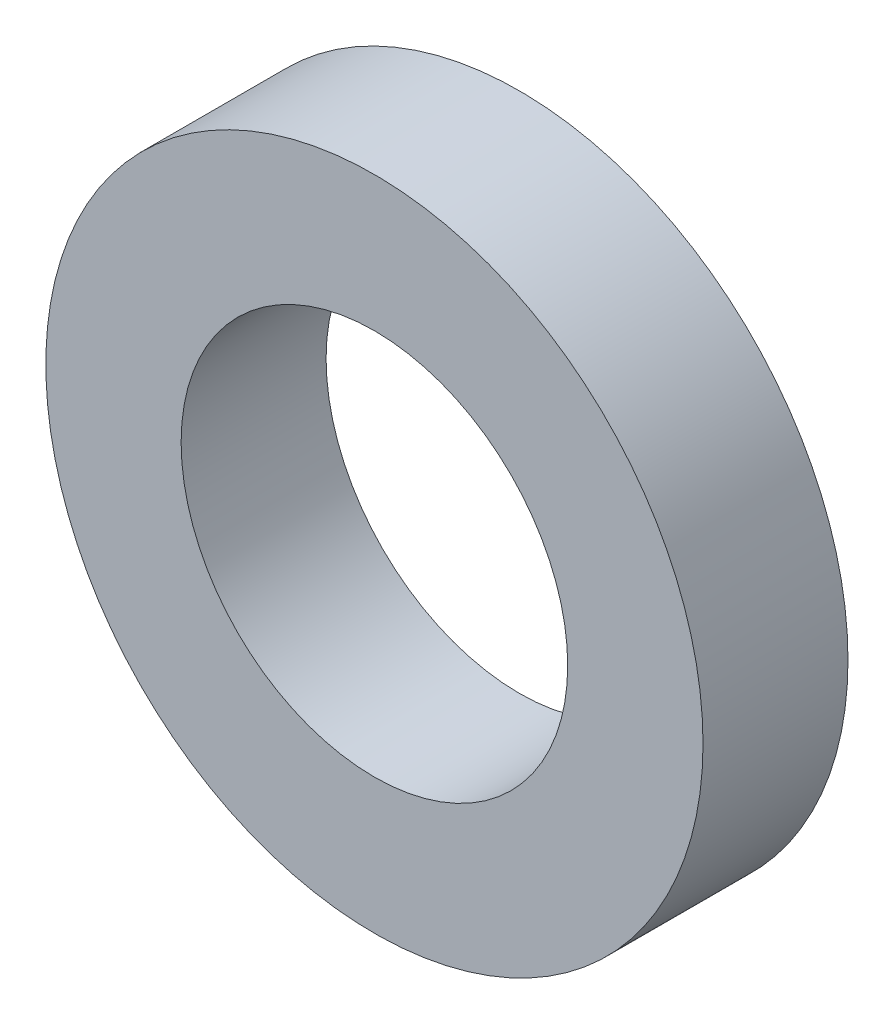
from build123d import *

# Parameters (mm, degrees)
SKETCH_1_R      = 34
SKETCH_1_R_2    = 20
EXTRUDE_1_DEPTH = 7.5


with BuildPart() as part:
    # 草图1 → 凸台-拉伸1 (new, symmetric)
    with BuildSketch(Plane.XY):
        Circle(SKETCH_1_R)
        Circle(SKETCH_1_R_2, mode=Mode.SUBTRACT)
    extrude(amount=EXTRUDE_1_DEPTH, both=True)


solid = part.part
